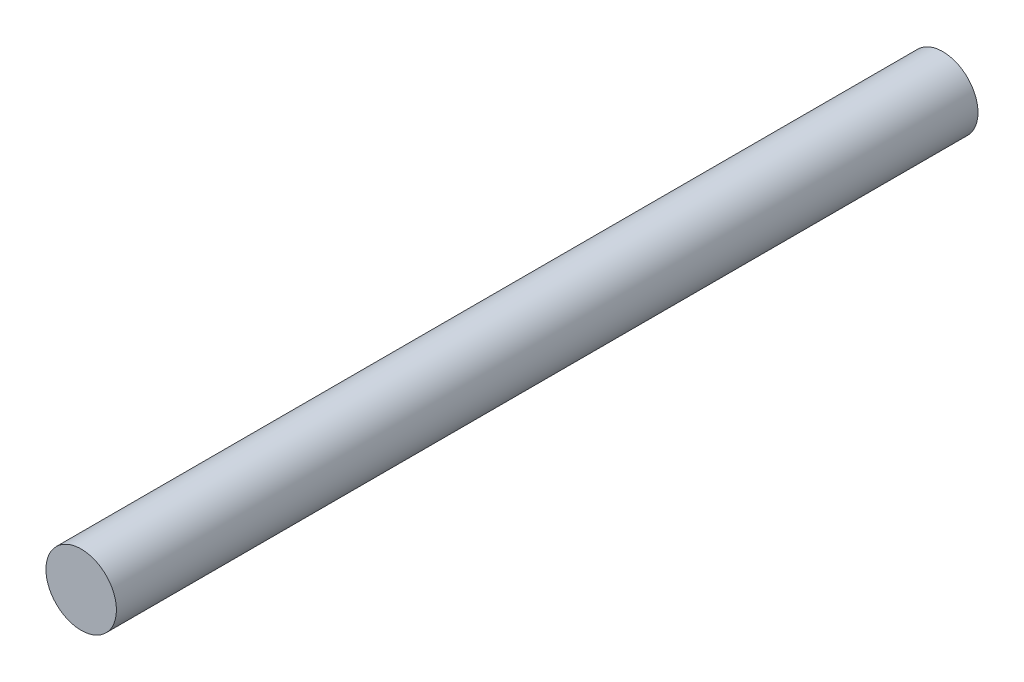
from build123d import *

# Parameters (mm, degrees)
SKETCH1_R           = 4.5
BOSS_EXTRUDE1_DEPTH = 110


with BuildPart() as part:
    # Sketch1 → Boss-Extrude1 (new body)
    with BuildSketch(Plane.XY):
        Circle(SKETCH1_R)
    extrude(amount=BOSS_EXTRUDE1_DEPTH)


solid = part.part
